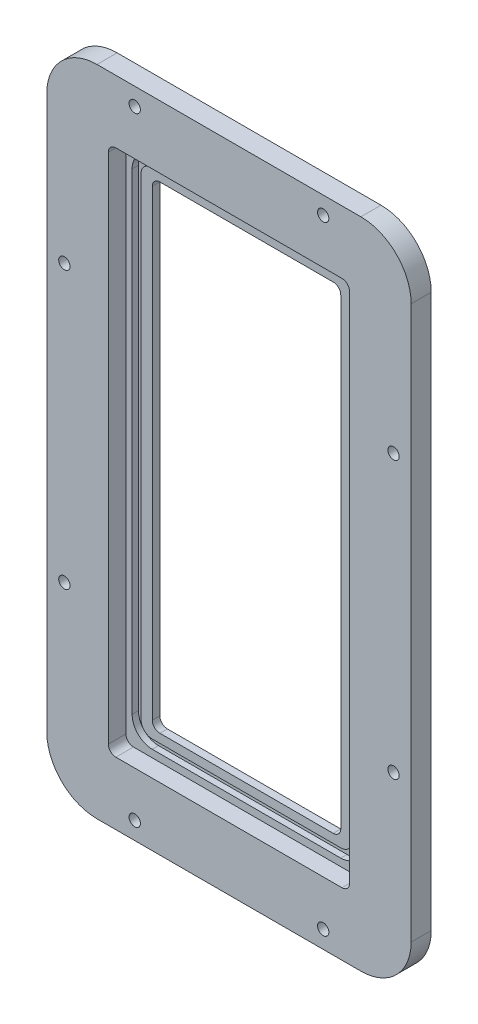
from build123d import *

# Parameters (mm, degrees)
ESBO_O1_W                                           = 145
ESBO_O1_H                                           = 260
RESSALTO_EXTRUS_O1_DEPTH                            = 10
ESBO_O2_W                                           = 145
ESBO_O2_H                                           = 260
CORTE_EXTRUS_O3_DEPTH                               = 2
CORTE_EXTRUS_O4_DEPTH                               = 150.185287478
REBAIXO_PARA_PARAFUSO_COM_CABE_A_PANELA_D           = 4.5
REBAIXO_PARA_PARAFUSO_COM_CABE_A_PANELA_CBORE_D     = 9
REBAIXO_PARA_PARAFUSO_COM_CABE_A_PANELA_CBORE_DEPTH = 3.1
CORTE_EXTRUS_O5_DEPTH                               = 7
ESBO_O4_W                                           = 3.53
ESBO_O4_H                                           = 2.765
ESBO_O13_W                                          = 3.53
ESBO_O13_H                                          = 2.5
FILETE1_R                                           = 20


with BuildPart() as part:
    # Esboço1 → Ressalto-extrusão1 (new body)
    with BuildSketch(Plane.XY):
        Rectangle(ESBO_O1_W, ESBO_O1_H)
    extrude(amount=RESSALTO_EXTRUS_O1_DEPTH)

    # Esboço2 → Corte-extrusão3 (cut)
    with BuildSketch(Plane.XY):
        Rectangle(ESBO_O2_W, ESBO_O2_H)
        with BuildLine():
            Line((-46.5, -110), (46.5, -110))
            ThreePointArc((46.5, -110), (50.742640687, -108.242640687), (52.5, -104))
            Line((52.5, -104), (52.5, 104))
            ThreePointArc((52.5, 104), (50.742640687, 108.242640687), (46.5, 110))
            Line((46.5, 110), (-46.5, 110))
            ThreePointArc((-46.5, 110), (-50.742640687, 108.242640687), (-52.5, 104))
            Line((-52.5, 104), (-52.5, -104))
            ThreePointArc((-52.5, -104), (-50.742640687, -108.242640687), (-46.5, -110))
        make_face(mode=Mode.SUBTRACT)
    extrude(amount=CORTE_EXTRUS_O3_DEPTH, mode=Mode.SUBTRACT)

    # Esboço5 → Corte-extrusão4 (cut, through all)
    with BuildSketch(Plane(origin=(0, 0, 0), x_dir=(-1, 0, 0), z_dir=(0, 0, -1))):
        with BuildLine():
            Line((-34.5, -95), (34.5, -95))
            ThreePointArc((34.5, -95), (36.621320344, -94.121320344), (37.5, -92))
            Line((37.5, -92), (37.5, 92))
            ThreePointArc((37.5, 92), (36.621320344, 94.121320344), (34.5, 95))
            Line((34.5, 95), (-34.5, 95))
            ThreePointArc((-34.5, 95), (-36.621320344, 94.121320344), (-37.5, 92))
            Line((-37.5, 92), (-37.5, -92))
            ThreePointArc((-37.5, -92), (-36.621320344, -94.121320344), (-34.5, -95))
        make_face()
    extrude(amount=-CORTE_EXTRUS_O4_DEPTH, mode=Mode.SUBTRACT)

    # Rebaixo para parafuso com cabeça panela de M41 (through all)
    with Locations(Plane(origin=(0, 0, 2), x_dir=(-1, 0, 0), z_dir=(0, 0, -1))):
        with Locations((-37.5, 123), (37.5, 123), (65.5, 55), (65.5, -55), (37.5, -123), (-37.5, -123), (-65.5, -55), (-65.5, 55)):
            CounterBoreHole(REBAIXO_PARA_PARAFUSO_COM_CABE_A_PANELA_D / 2, REBAIXO_PARA_PARAFUSO_COM_CABE_A_PANELA_CBORE_D / 2, REBAIXO_PARA_PARAFUSO_COM_CABE_A_PANELA_CBORE_DEPTH)

    # Esboço9 → Corte-extrusão5 (cut)
    with BuildSketch(Plane.XY.offset(10)):
        with BuildLine():
            Line((-45, -105), (45, -105))
            ThreePointArc((45, -105), (47.121320344, -104.121320344), (48, -102))
            Line((48, -102), (48, 102))
            ThreePointArc((48, 102), (47.121320344, 104.121320344), (45, 105))
            Line((45, 105), (-45, 105))
            ThreePointArc((-45, 105), (-47.121320344, 104.121320344), (-48, 102))
            Line((-48, 102), (-48, -102))
            ThreePointArc((-48, -102), (-47.121320344, -104.121320344), (-45, -105))
        make_face()
    extrude(amount=-CORTE_EXTRUS_O5_DEPTH, mode=Mode.SUBTRACT)

    # Varredura de corte3: sweep along a path in Esboço14
    with BuildLine(Plane(origin=(0, 0, 2), x_dir=(-1, 0, 0), z_dir=(0, 0, -1))) as varredura_de_corte3_path:
        Line((-47.5, -115), (47.5, -115))
        ThreePointArc((47.5, -115), (54.571067812, -112.071067812), (57.5, -105))
        Line((57.5, -105), (57.5, 105))
        ThreePointArc((57.5, 105), (54.571067812, 112.071067812), (47.5, 115))
        Line((47.5, 115), (-47.5, 115))
        ThreePointArc((-47.5, 115), (-54.571067812, 112.071067812), (-57.5, 105))
        Line((-57.5, 105), (-57.5, -105))
        ThreePointArc((-57.5, -105), (-54.571067812, -112.071067812), (-47.5, -115))
    # Esboço4 → Varredura de corte3 (sweep, cut)
    with BuildSketch(Plane(origin=(0, 0, 0), x_dir=(1, 0, 0), z_dir=(0, 1, 0))):
        with Locations((57.5, -3.3825)):
            Rectangle(ESBO_O4_W, ESBO_O4_H)
    sweep(path=varredura_de_corte3_path.line, mode=Mode.SUBTRACT)

    # Varredura de corte2: sweep along a path in Esboço11
    with BuildLine(Plane.XY.offset(3)) as varredura_de_corte2_path:
        Line((-37.5, -100), (37.5, -100))
        ThreePointArc((37.5, -100), (41.742640687, -98.242640687), (43.5, -94))
        Line((43.5, -94), (43.5, 94))
        ThreePointArc((43.5, 94), (41.742640687, 98.242640687), (37.5, 100))
        Line((37.5, 100), (-37.5, 100))
        ThreePointArc((-37.5, 100), (-41.742640687, 98.242640687), (-43.5, 94))
        Line((-43.5, 94), (-43.5, -94))
        ThreePointArc((-43.5, -94), (-41.742640687, -98.242640687), (-37.5, -100))
    # Esboço13 → Varredura de corte2 (sweep, cut)
    with BuildSketch(Plane(origin=(0, 0, 0), x_dir=(1, 0, 0), z_dir=(0, 1, 0))):
        with Locations((43.765, -1.75)):
            Rectangle(ESBO_O13_W, ESBO_O13_H)
    sweep(path=varredura_de_corte2_path.line, mode=Mode.SUBTRACT)

    # Filete1
    filete1_edges = [part.edges().sort_by_distance(p)[0] for p in [
        (72.5, -130, 6),
        (-72.5, -130, 6),
        (-72.5, 130, 6),
        (72.5, 130, 6),
    ]]
    fillet(filete1_edges, radius=FILETE1_R)


solid = part.part
